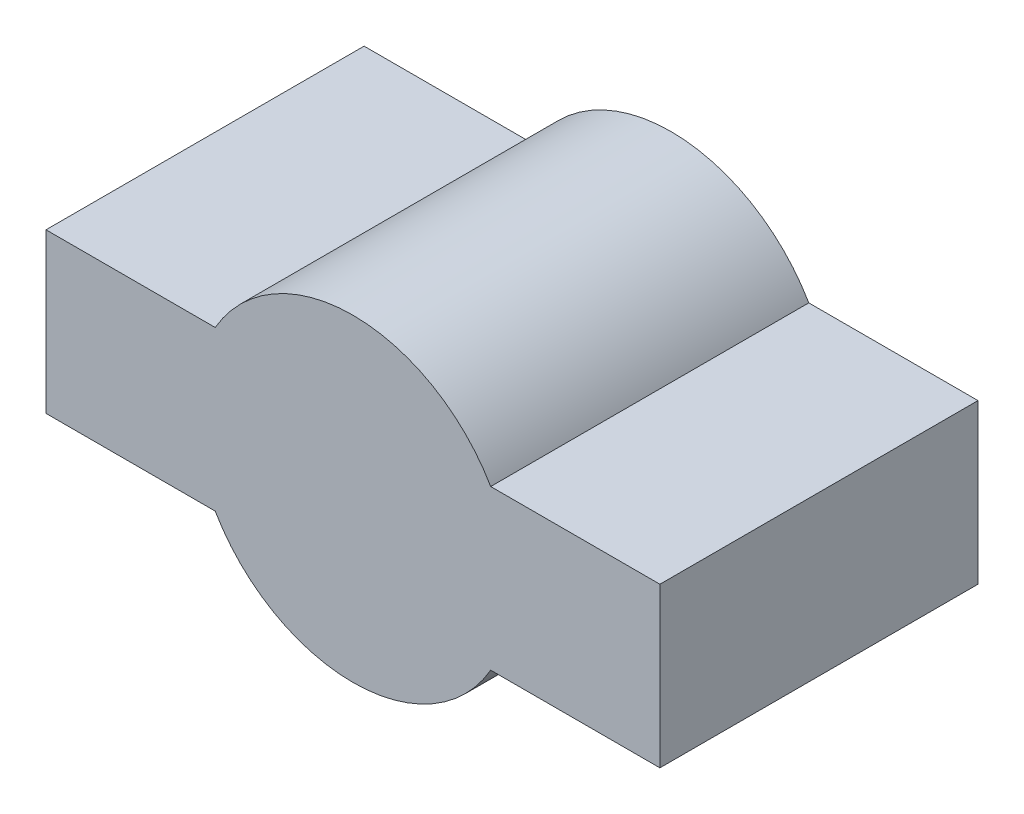
from build123d import *

# Parameters (mm, degrees)
BOSS_EXTRUDE1_DEPTH = 2
SKETCH2_R           = 0.95
CUT_EXTRUDE1_DEPTH  = 1.8


with BuildPart() as part:
    # Sketch1 → Boss-Extrude1 (new body)
    with BuildSketch(Plane.XY):
        with BuildLine():
            Line((0.866025404, 0.5), (1.93, 0.5))
            Line((1.93, 0.5), (1.93, -0.5))
            Line((1.93, -0.5), (0.866025404, -0.5))
            ThreePointArc((0.866025404, -0.5), (0, -1), (-0.866025404, -0.5))
            Line((-0.866025404, -0.5), (-1.93, -0.5))
            Line((-1.93, -0.5), (-1.93, 0.5))
            Line((-1.93, 0.5), (-0.866025404, 0.5))
            ThreePointArc((-0.866025404, 0.5), (0, 1), (0.866025404, 0.5))
        make_face()
    extrude(amount=BOSS_EXTRUDE1_DEPTH)

    # Sketch2 → Cut-Extrude1 (cut)
    with BuildSketch(Plane(origin=(0, 0, 0), x_dir=(-1, 0, 0), z_dir=(0, 0, -1))):
        Circle(SKETCH2_R)
    extrude(amount=-CUT_EXTRUDE1_DEPTH, mode=Mode.SUBTRACT)


solid = part.part
